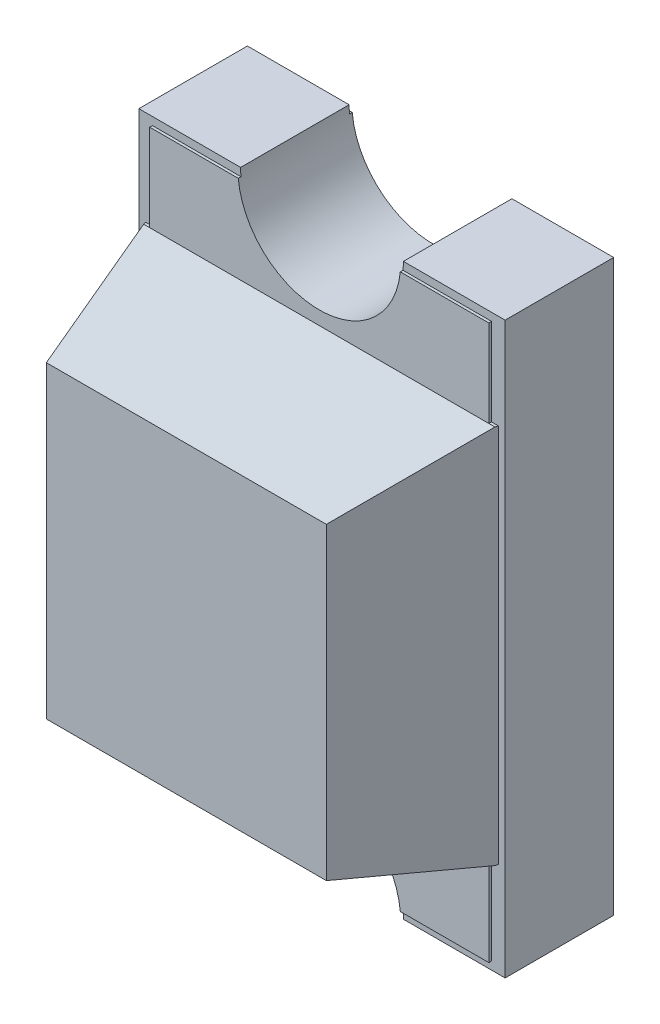
from build123d import *

# Parameters (mm, degrees)
SKETCH1_W                = 1.35
SKETCH1_H                = 2.1
BOSS_EXTRUDE1_DEPTH      = 0.4
BOSS_EXTRUDE2_DEPTH      = 0.01
BOSS_EXTRUDE2_DEPTH_BACK = 0.41
SKETCH3_W                = 1.25
SKETCH3_H                = 0.5
CUT_EXTRUDE1_DEPTH       = 2.31385882
CUT_EXTRUDE1_DEPTH_BACK  = 2.31385882
SKETCH2_R                = 0.3
SKETCH4_W                = 1.3
SKETCH4_H                = 1.4
BOSS_EXTRUDE3_DEPTH      = 0.5
CUT_EXTRUDE2_DEPTH       = 3.080414622
CUT_EXTRUDE3_DEPTH       = 2.932614809


with BuildPart() as part:
    # Sketch1 → Boss-Extrude1 (new body)
    with BuildSketch(Plane.XY):
        Rectangle(SKETCH1_W, SKETCH1_H)
    extrude(amount=BOSS_EXTRUDE1_DEPTH)

    # Sketch3 → Boss-Extrude2 (add, two sides: drawn at the far end of the back side and taken through both)
    with BuildSketch(Plane.XY.offset(0.4).offset(-BOSS_EXTRUDE2_DEPTH_BACK)):
        with Locations((0, 0.770937726)):
            Rectangle(SKETCH3_W, SKETCH3_H)
        with Locations((0, -0.770937726)):
            Rectangle(SKETCH3_W, SKETCH3_H)
    extrude(amount=BOSS_EXTRUDE2_DEPTH + BOSS_EXTRUDE2_DEPTH_BACK)

    # Sketch2 → Cut-Extrude1 (cut, two sides: drawn at the far end of the back side and taken through both)
    with BuildSketch(Plane.XY.offset(0.4).offset(-CUT_EXTRUDE1_DEPTH_BACK)):
        with Locations((0, 1.05)):
            Circle(SKETCH2_R)
        with Locations((0, -1.05)):
            Circle(SKETCH2_R)
    extrude(amount=CUT_EXTRUDE1_DEPTH + CUT_EXTRUDE1_DEPTH_BACK, mode=Mode.SUBTRACT)

    # Sketch4 → Boss-Extrude3 (add)
    with BuildSketch(Plane.XY.offset(0.4)):
        Rectangle(SKETCH4_W, SKETCH4_H)
    extrude(amount=BOSS_EXTRUDE3_DEPTH)

    # Sketch5 → Cut-Extrude2 (cut, through all)
    with BuildSketch(Plane.XZ.offset(0.7)):
        Polygon((-0.516025404, 0.9), (-0.862722343, 0.9), (-0.862722343, 0.4), (-0.65, 0.4), align=None)
        Polygon((0.862722343, 0.4), (0.65, 0.4), (0.516025404, 0.9), (0.862722343, 0.9), align=None)
    extrude(amount=-CUT_EXTRUDE2_DEPTH, mode=Mode.SUBTRACT)

    # Sketch6 → Cut-Extrude3 (cut, through all)
    with BuildSketch(Plane.ZY.offset(0.675)):
        Polygon((0.41, -0.7), (0.9, -0.7), (0.9, -0.568704896), align=None)
        Polygon((0.9, 0.7), (0.9, 0.568704896), (0.41, 0.7), align=None)
    extrude(amount=-CUT_EXTRUDE3_DEPTH, mode=Mode.SUBTRACT)


solid = part.part
